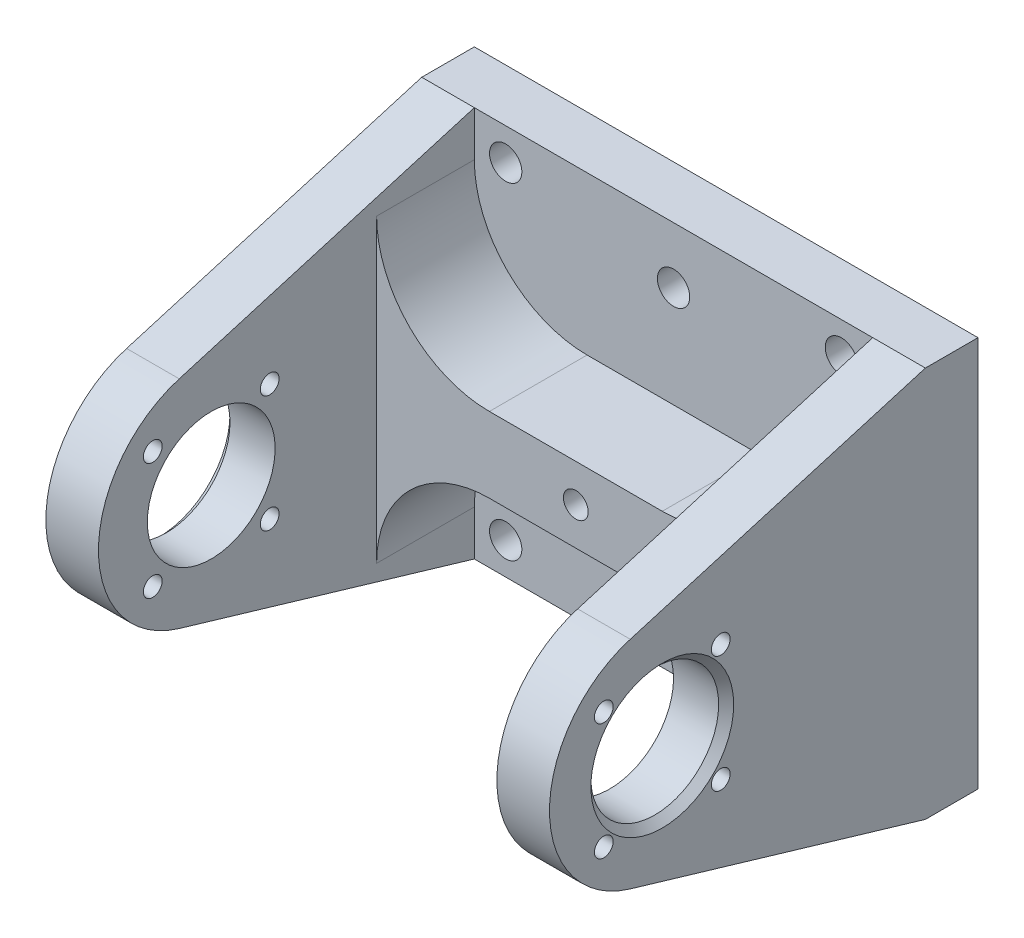
from build123d import *

# Parameters (mm, degrees)
SKETCH1_R                                           = 8.5
BOSS_EXTRUDE1_DEPTH                                 = 33.5
SKETCH2_W                                           = 53
SKETCH2_H                                           = 50
CUT_EXTRUDE1_DEPTH                                  = 30
SKETCH3_W                                           = 53
SKETCH3_H                                           = 10
BOSS_EXTRUDE2_DEPTH                                 = 13
FILLET1_R                                           = 15
CSK_FOR_M4_COUNTERSUNK_FLAT_HEAD_SCREW1_D           = 4.3
CSK_FOR_M4_COUNTERSUNK_FLAT_HEAD_SCREW1_CSINK_D     = 9.4
CSK_FOR_M4_COUNTERSUNK_FLAT_HEAD_SCREW1_CSINK_ANGLE = 90
M4_TAPPED_HOLE1_D                                   = 3.3
CHAMFER1_SIZE                                       = 1
M3_TAPPED_HOLE2_D                                   = 2.5
M3_TAPPED_HOLE2_DEPTH                               = 7
M4_TAPPED_HOLE2_D                                   = 3.3
M4_TAPPED_HOLE2_DEPTH                               = 16
M4_TAPPED_HOLE2_TIP                                 = 0.991420021
M4_CLEARANCE_HOLE1_D                                = 4.3


with BuildPart() as part:
    # Sketch1 → Boss-Extrude1 (new, symmetric)
    with BuildSketch(Plane(origin=(0, 0, 0), x_dir=(0, 0, -1), z_dir=(1, 0, 0))):
        with BuildLine():
            Line((-7, 26), (-46.256287113, 14.383463422))
            ThreePointArc((-46.256287113, 14.383463422), (-57, 0), (-46.256287113, -14.383463422))
            Line((-46.256287113, -14.383463422), (-7, -26))
            Line((-7, -26), (0, -26))
            Line((0, -26), (0, 26))
            Line((0, 26), (-7, 26))
        make_face()
        with Locations((-42, 0)):
            Circle(SKETCH1_R, mode=Mode.SUBTRACT)
    extrude(amount=BOSS_EXTRUDE1_DEPTH, both=True)

    # Sketch2 → Cut-Extrude1 (cut, symmetric)
    with BuildSketch(Plane(origin=(0, 0, 0), x_dir=(1, 0, 0), z_dir=(0, 1, 0))):
        with Locations((0, -32)):
            Rectangle(SKETCH2_W, SKETCH2_H)
    extrude(amount=CUT_EXTRUDE1_DEPTH, both=True, mode=Mode.SUBTRACT)

    # Sketch3 → Boss-Extrude2 (add)
    with BuildSketch(Plane.XY.offset(7)):
        Rectangle(SKETCH3_W, SKETCH3_H)
    extrude(amount=BOSS_EXTRUDE2_DEPTH)

    # Fillet1
    fillet1_edges = [part.edges().sort_by_distance(p)[0] for p in [
        (-26.5, 5, 13.5),
        (-26.5, -5, 13.5),
        (26.5, -5, 13.5),
        (26.5, 5, 13.5),
    ]]
    fillet(fillet1_edges, radius=FILLET1_R)

    # CSK for M4 Countersunk Flat Head Screw1 (through all)
    with Locations(Plane(origin=(0, 0, 0), x_dir=(-1, 0, 0), z_dir=(0, 0, -1))):
        with Locations((0, 18.5), (0, -18.5)):
            CounterSinkHole(CSK_FOR_M4_COUNTERSUNK_FLAT_HEAD_SCREW1_D / 2, CSK_FOR_M4_COUNTERSUNK_FLAT_HEAD_SCREW1_CSINK_D / 2, counter_sink_angle=CSK_FOR_M4_COUNTERSUNK_FLAT_HEAD_SCREW1_CSINK_ANGLE)

    # M4 Tapped Hole1 (through all)
    with Locations(Plane.XY.offset(20)):
        with Locations((0, 0)):
            Hole(M4_TAPPED_HOLE1_D / 2)

    # Chamfer1
    chamfer1_edges = [part.edges().sort_by_distance(p)[0] for p in [
        (-33.5, 0, 50.5),
        (33.5, 0, 50.5),
    ]]
    chamfer(chamfer1_edges, length=CHAMFER1_SIZE)

    # M3 Tapped Hole2
    with Locations(Plane(origin=(33.5, 0, 0), x_dir=(0, 0, -1), z_dir=(1, 0, 0))):
        with Locations((-34.221825407, 7.778174593), (-49.778174593, 7.778174593), (-34.221825407, -7.778174593), (-49.778174593, -7.778174593)):
            m3_tapped_hole2 = Hole(M3_TAPPED_HOLE2_D / 2, depth=M3_TAPPED_HOLE2_DEPTH)

    # Mirror1: M3 Tapped Hole2 across plane
    add(m3_tapped_hole2.mirror(Plane(origin=(0, 0, 0), x_dir=(0, 0, 1), z_dir=(1, 0, 0))), mode=Mode.SUBTRACT)

    # M4 Tapped Hole2
    with Locations(Plane(origin=(0, 0, 0), x_dir=(-1, 0, 0), z_dir=(0, 0, -1))):
        with Locations((-30, 20), (-30, -20), (30, 20), (30, -20), (-30, 0), (30, 0)):
            Hole(M4_TAPPED_HOLE2_D / 2, depth=M4_TAPPED_HOLE2_DEPTH)
            with Locations((0, 0, -(M4_TAPPED_HOLE2_DEPTH + M4_TAPPED_HOLE2_TIP / 2))):  # 118° drill point
                Cone(0, M4_TAPPED_HOLE2_D / 2, M4_TAPPED_HOLE2_TIP, mode=Mode.SUBTRACT)

    # M4 Clearance Hole1 (through all)
    with Locations(Plane(origin=(0, 0, 0), x_dir=(-1, 0, 0), z_dir=(0, 0, -1))):
        with Locations((-22.33, 21.75), (22.33, -21.75), (22.33, 21.75), (-22.33, -21.75)):
            Hole(M4_CLEARANCE_HOLE1_D / 2)


solid = part.part
